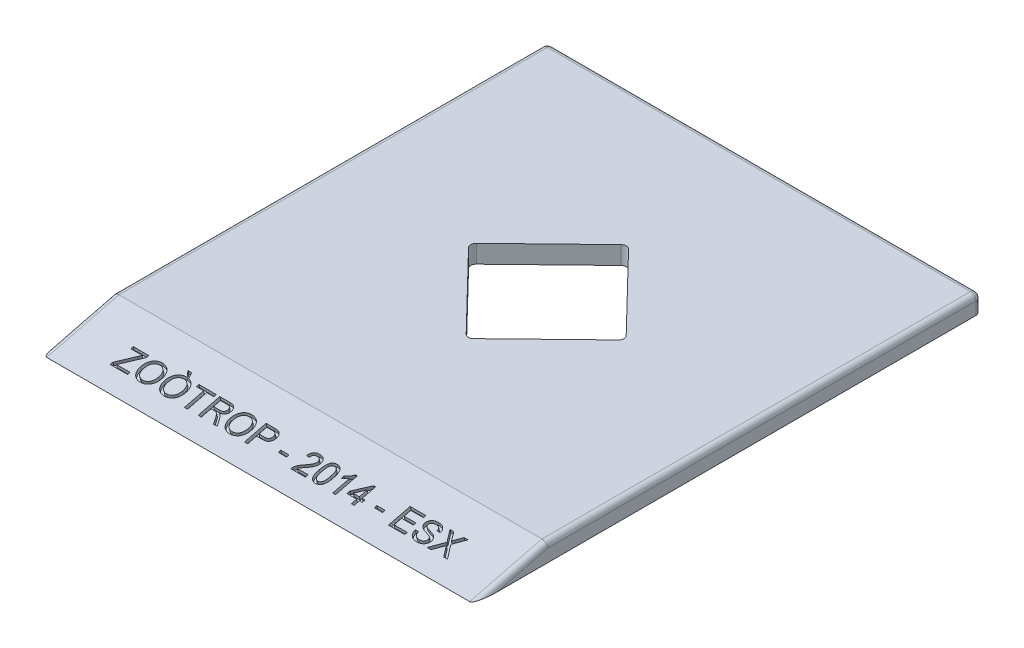
from build123d import *

# Parameters (mm, degrees)
SALIENTE_EXTRUIR1_DEPTH = 60
CROQUIS3_W              = 2.291730519
CROQUIS3_H              = 0.711226712
CORTAR_EXTRUIR1_DEPTH   = 1
CORTAR_EXTRUIR2_DEPTH   = 21
REDONDEO1_R             = 1.5
REDONDEO2_R             = 1.5


with BuildPart() as part:
    # Croquis2 → Saliente-Extruir1 (new, symmetric)
    with BuildSketch(Plane(origin=(0, 0, 0), x_dir=(0, 0, -1), z_dir=(1, 0, 0))):
        Polygon((60, 0), (-80, 0), (-60, 5), (60, 5), align=None)
    extrude(amount=SALIENTE_EXTRUIR1_DEPTH, both=True)

    # Croquis3 → Cortar-Extruir1 (cut)
    # profile 1 of 17: a face of its own
    with BuildSketch(Plane(origin=(0, 18.823529412, 4.705882353), x_dir=(1, 0, 0), z_dir=(0, 0.970142500145332, 0.24253562503633277))):
        with BuildLine():
            Line((-46.585349684, -71.764938026), (-46.585349684, -71.024076867))
            Line((-46.585349684, -71.024076867), (-43.550288469, -67.019722302))
            add(Edge.make_bspline(
                [(-43.550288469, -67.019722302), (-43.498711012, -66.952319346), (-43.399809549, -66.823071968), (-43.260120106, -66.636316957), (-43.13098584, -66.469147715), (-43.050921883, -66.362496205), (-43.013164129, -66.312199895)],
                knots=[0, 0, 0, 0, 1.146521337, 2.198492228, 3.150418105, 4, 4, 4, 4], degree=3))
            Line((-43.013164129, -66.312199895), (-46.190223733, -66.312199895))
            Line((-46.190223733, -66.312199895), (-46.190223733, -65.600973183))
            Line((-46.190223733, -65.600973183), (-41.922863457, -65.600973183))
            Line((-41.922863457, -65.600973183), (-41.922863457, -66.312199895))
            Line((-41.922863457, -66.312199895), (-45.215991309, -70.657350593))
            Line((-45.215991309, -70.657350593), (-45.516040078, -71.053711314))
            Line((-45.516040078, -71.053711314), (-41.764813076, -71.053711314))
            Line((-41.764813076, -71.053711314), (-41.764813076, -71.764938026))
            Line((-41.764813076, -71.764938026), (-46.585349684, -71.764938026))
        make_face()
    # profile 2 of 17: a face of its own
    with BuildSketch(Plane(origin=(0, 18.823529412, 4.705882353), x_dir=(1, 0, 0), z_dir=(0, 0.970142500145332, 0.24253562503633277))):
        with BuildLine():
            add(Edge.make_bspline(
                [(-41.132611553, -68.764450332), (-41.130469197, -68.64086815), (-41.126294923, -68.400074535), (-41.087292432, -68.049448004), (-41.023962397, -67.719554304), (-40.933426509, -67.410419134), (-40.818672011, -67.121558079), (-40.679165997, -66.852317055), (-40.510712219, -66.605743679), (-40.320148069, -66.379490731), (-40.107296667, -66.179466541), (-39.880670421, -66.001816403), (-39.637439481, -65.853635185), (-39.379851114, -65.731286351), (-39.106810939, -65.637350459), (-38.819085569, -65.571586787), (-38.516982724, -65.529162827), (-38.31048836, -65.524387869), (-38.204975206, -65.521947992)],
                knots=[0, 0, 0, 0, 1.203621547, 2.345195544, 3.432004029, 4.472479546, 5.478447225, 6.455936844, 7.420185704, 8.381829745, 9.332027588, 10.260832629, 11.182364398, 12.100723901, 13.034044877, 13.989196293, 14.972532542, 16, 16, 16, 16], degree=3))
            add(Edge.make_bspline(
                [(-38.204975206, -65.521947992), (-38.135382031, -65.52316322), (-37.997182573, -65.525576443), (-37.792867008, -65.543937845), (-37.593801634, -65.576709767), (-37.400182482, -65.620627817), (-37.211482518, -65.678246389), (-37.027589054, -65.74626336), (-36.850111872, -65.830545964), (-36.677870264, -65.924908726), (-36.512897415, -66.030457556), (-36.357856344, -66.147057134), (-36.213118424, -66.273825624), (-36.076739432, -66.408679295), (-35.953270144, -66.556169272), (-35.837609728, -66.711802758), (-35.733081755, -66.878339385), (-35.639315336, -67.054414669), (-35.55547863, -67.237309159), (-35.483823975, -67.427780878), (-35.42229543, -67.623544985), (-35.370790847, -67.825760193), (-35.333834919, -68.034357372), (-35.304406514, -68.248437697), (-35.288917532, -68.468700855), (-35.286149217, -68.617492543), (-35.284747471, -68.692833753)],
                knots=[0, 0, 0, 0, 1.034375294, 2.054082248, 3.045783978, 4.031219655, 5.002789406, 5.976610191, 6.94273282, 7.920236376, 8.894345378, 9.851183672, 10.800797181, 11.752517031, 12.698794154, 13.65688337, 14.632873302, 15.61821402, 16.620222298, 17.621258913, 18.640965868, 19.669244166, 20.720417492, 21.788124603, 22.880008887, 24, 24, 24, 24], degree=3))
            add(Edge.make_bspline(
                [(-35.284747471, -68.692833753), (-35.286031776, -68.769417341), (-35.288569141, -68.920721425), (-35.305737993, -69.144243849), (-35.335926802, -69.361349408), (-35.375967117, -69.572685472), (-35.429619918, -69.777812082), (-35.493378026, -69.977317349), (-35.57049706, -70.17001298), (-35.657594447, -70.356363411), (-35.756145103, -70.533805677), (-35.864853164, -70.701099019), (-35.983795642, -70.856678539), (-36.111165815, -71.0024528), (-36.249938114, -71.135815086), (-36.398403748, -71.258012433), (-36.555991866, -71.370197301), (-36.723231886, -71.469331371), (-36.897122457, -71.556225925), (-37.074222558, -71.63331705), (-37.254663744, -71.699063428), (-37.439062706, -71.752344333), (-37.626916424, -71.79260722), (-37.817696254, -71.822756495), (-38.012027599, -71.840116551), (-38.142792033, -71.842674406), (-38.208679512, -71.843963217)],
                knots=[0, 0, 0, 0, 1.141429366, 2.255090526, 3.338676798, 4.407031443, 5.458968682, 6.496860253, 7.526652771, 8.550250826, 9.560787671, 10.54935636, 11.521089193, 12.477323897, 13.431786008, 14.386110112, 15.340986122, 16.312041, 17.28047646, 18.236612773, 19.189437236, 20.140779471, 21.09494583, 22.051062463, 23.018000708, 24, 24, 24, 24], degree=3))
            add(Edge.make_bspline(
                [(-38.208679512, -71.843963217), (-38.279523186, -71.842915076), (-38.419846762, -71.840838971), (-38.627248787, -71.820115907), (-38.829490976, -71.788502151), (-39.025985374, -71.742861439), (-39.216463479, -71.683319905), (-39.401150672, -71.611252717), (-39.580696516, -71.527623029), (-39.752873144, -71.43003625), (-39.917094539, -71.321530242), (-40.071769005, -71.202644383), (-40.216811015, -71.074474312), (-40.349893237, -70.93490153), (-40.475325787, -70.788985606), (-40.588093306, -70.631302934), (-40.691878607, -70.465429592), (-40.783610512, -70.289766634), (-40.86647656, -70.109534096), (-40.936292996, -69.924674327), (-40.997648112, -69.737911668), (-41.046511251, -69.548094993), (-41.085449227, -69.355662166), (-41.111632194, -69.160933387), (-41.130541732, -68.963618642), (-41.131918141, -68.831173863), (-41.132611553, -68.764450332)],
                knots=[0, 0, 0, 0, 1.072727997, 2.12480551, 3.153819198, 4.171534612, 5.177148798, 6.173931848, 7.17235114, 8.174500385, 9.168706755, 10.151274001, 11.127173509, 12.097141049, 13.070188938, 14.039134204, 15.03036519, 16.031505612, 17.038625933, 18.033164522, 19.022845559, 20.014762458, 21.000193215, 21.994692725, 22.989758729, 24, 24, 24, 24], degree=3))
        make_face()
        with BuildLine():
            add(Edge.make_bspline(
                [(-40.26333446, -68.774328481), (-40.262002334, -68.863318802), (-40.259404783, -69.036843649), (-40.229687386, -69.289833648), (-40.184595984, -69.528542596), (-40.122442246, -69.753640606), (-40.038892401, -69.962901492), (-39.938997743, -70.158336047), (-39.819394796, -70.338645135), (-39.682722358, -70.50332436), (-39.532398344, -70.651259836), (-39.371761879, -70.780473605), (-39.200776853, -70.888680996), (-39.02133894, -70.978029297), (-38.83215932, -71.047773793), (-38.633804588, -71.096746621), (-38.426129006, -71.12737515), (-38.284519869, -71.130927121), (-38.212383818, -71.132736504)],
                knots=[0, 0, 0, 0, 1.215430442, 2.370003584, 3.475209778, 4.53279855, 5.55522989, 6.548792651, 7.526809858, 8.505409025, 9.467826767, 10.404123909, 11.316848639, 12.227335424, 13.138360512, 14.065900994, 15.014765094, 16, 16, 16, 16], degree=3))
            add(Edge.make_bspline(
                [(-38.212383818, -71.132736504), (-38.139025058, -71.130900359), (-37.995388812, -71.127305192), (-37.784582238, -71.097211341), (-37.584292394, -71.045977842), (-37.392534051, -70.977774448), (-37.212774013, -70.885575087), (-37.040808207, -70.77761014), (-36.881324442, -70.645680066), (-36.730407844, -70.497482951), (-36.595045822, -70.329029712), (-36.474940524, -70.144469887), (-36.377375434, -69.94103555), (-36.293141146, -69.723208081), (-36.231459946, -69.486870456), (-36.18587376, -69.234709361), (-36.158402559, -68.965913671), (-36.1555097, -68.781390418), (-36.154024564, -68.68665991)],
                knots=[0, 0, 0, 0, 0.976878588, 1.912725521, 2.8289017, 3.727303729, 4.617335839, 5.514666588, 6.426584173, 7.368641557, 8.327632997, 9.299405846, 10.294892156, 11.327373912, 12.405931897, 13.542618837, 14.738430195, 16, 16, 16, 16], degree=3))
            add(Edge.make_bspline(
                [(-36.154024564, -68.68665991), (-36.154549411, -68.625716468), (-36.155578969, -68.506167488), (-36.169213773, -68.329950923), (-36.186800922, -68.159215703), (-36.213577628, -67.994182136), (-36.250479327, -67.835533665), (-36.291360143, -67.682062495), (-36.342480174, -67.535091156), (-36.400482973, -67.394043283), (-36.465387123, -67.259642988), (-36.538590372, -67.133023321), (-36.619241948, -67.01467655), (-36.705165778, -66.902358939), (-36.801119837, -66.800417642), (-36.902483881, -66.70454661), (-37.01156039, -66.616726559), (-37.127260821, -66.536934549), (-37.247943813, -66.465109166), (-37.373360579, -66.403635957), (-37.501513051, -66.349639466), (-37.634546321, -66.308248889), (-37.770623456, -66.274866782), (-37.910294551, -66.249509962), (-38.054078028, -66.236379021), (-38.151034049, -66.234250481), (-38.200036132, -66.233174705)],
                knots=[0, 0, 0, 0, 1.220438779, 2.394059227, 3.538503547, 4.658058814, 5.74010225, 6.800155734, 7.837851593, 8.854470756, 9.853724944, 10.825214244, 11.781044712, 12.72106398, 13.654479919, 14.581868691, 15.514082315, 16.456304431, 17.39516604, 18.324312202, 19.252140633, 20.177768678, 21.111585046, 22.057694709, 23.018348693, 24, 24, 24, 24], degree=3))
            add(Edge.make_bspline(
                [(-38.200036132, -66.233174705), (-38.269293891, -66.234550137), (-38.405947168, -66.237264017), (-38.607117059, -66.267433008), (-38.801066646, -66.312509604), (-38.988096917, -66.375529086), (-39.166608232, -66.458976785), (-39.337525442, -66.561313968), (-39.502365689, -66.679754154), (-39.658529676, -66.817183112), (-39.804108669, -66.975055436), (-39.927181103, -67.16118207), (-40.030909913, -67.371119778), (-40.117521559, -67.604336418), (-40.183560388, -67.862638098), (-40.229201479, -68.144913225), (-40.258018333, -68.451459247), (-40.261517115, -68.663954016), (-40.26333446, -68.774328481)],
                knots=[0, 0, 0, 0, 0.895090134, 1.766112571, 2.624765742, 3.468151641, 4.313618154, 5.168136083, 6.041303099, 6.935189387, 7.854749729, 8.809996334, 9.809869957, 10.877771942, 12.021723904, 13.25217762, 14.572720513, 16, 16, 16, 16], degree=3))
        make_face(mode=Mode.SUBTRACT)
    # profile 3 of 17: a face of its own
    with BuildSketch(Plane(origin=(0, 18.823529412, 4.705882353), x_dir=(1, 0, 0), z_dir=(0, 0.970142500145332, 0.24253562503633277))):
        with BuildLine():
            add(Edge.make_bspline(
                [(-34.494495568, -68.764450332), (-34.492353211, -68.64086815), (-34.488178937, -68.400074535), (-34.449176446, -68.049448004), (-34.385846412, -67.719554304), (-34.295310524, -67.410419134), (-34.180556026, -67.121558079), (-34.041050012, -66.852317055), (-33.872596233, -66.605743679), (-33.682032083, -66.379490731), (-33.469180681, -66.179466541), (-33.242554435, -66.001816403), (-32.999323495, -65.853635185), (-32.741735129, -65.731286351), (-32.468694954, -65.637350459), (-32.180969583, -65.571586787), (-31.878866739, -65.529162827), (-31.672372374, -65.524387869), (-31.566859221, -65.521947992)],
                knots=[0, 0, 0, 0, 1.203621547, 2.345195544, 3.432004029, 4.472479546, 5.478447225, 6.455936844, 7.420185704, 8.381829745, 9.332027588, 10.260832629, 11.182364398, 12.100723901, 13.034044877, 13.989196293, 14.972532542, 16, 16, 16, 16], degree=3))
            add(Edge.make_bspline(
                [(-31.566859221, -65.521947992), (-31.497266046, -65.52316322), (-31.359066587, -65.525576443), (-31.154751022, -65.543937845), (-30.955685649, -65.576709767), (-30.762066496, -65.620627817), (-30.573366532, -65.678246389), (-30.389473068, -65.74626336), (-30.211995887, -65.830545964), (-30.039754279, -65.924908726), (-29.874781429, -66.030457556), (-29.719740358, -66.147057134), (-29.575002439, -66.273825624), (-29.438623447, -66.408679295), (-29.315154158, -66.556169272), (-29.199493742, -66.711802758), (-29.094965769, -66.878339385), (-29.001199351, -67.054414669), (-28.917362644, -67.237309159), (-28.845707989, -67.427780878), (-28.784179444, -67.623544985), (-28.732674861, -67.825760193), (-28.695718934, -68.034357372), (-28.666290529, -68.248437697), (-28.650801546, -68.468700855), (-28.648033231, -68.617492543), (-28.646631485, -68.692833753)],
                knots=[0, 0, 0, 0, 1.034375294, 2.054082248, 3.045783978, 4.031219655, 5.002789406, 5.976610191, 6.94273282, 7.920236376, 8.894345378, 9.851183672, 10.800797181, 11.752517031, 12.698794154, 13.65688337, 14.632873302, 15.61821402, 16.620222298, 17.621258913, 18.640965868, 19.669244166, 20.720417492, 21.788124603, 22.880008887, 24, 24, 24, 24], degree=3))
            add(Edge.make_bspline(
                [(-28.646631485, -68.692833753), (-28.64791579, -68.769417341), (-28.650453155, -68.920721425), (-28.667622007, -69.144243849), (-28.697810816, -69.361349408), (-28.737851132, -69.572685472), (-28.791503932, -69.777812082), (-28.85526204, -69.977317349), (-28.932381074, -70.17001298), (-29.019478461, -70.356363411), (-29.118029117, -70.533805677), (-29.226737178, -70.701099019), (-29.345679656, -70.856678539), (-29.473049829, -71.0024528), (-29.611822128, -71.135815086), (-29.760287762, -71.258012433), (-29.917875881, -71.370197301), (-30.0851159, -71.469331371), (-30.259006471, -71.556225925), (-30.436106572, -71.63331705), (-30.616547758, -71.699063428), (-30.800946721, -71.752344333), (-30.988800439, -71.79260722), (-31.179580269, -71.822756495), (-31.373911613, -71.840116551), (-31.504676047, -71.842674406), (-31.570563527, -71.843963217)],
                knots=[0, 0, 0, 0, 1.141429366, 2.255090526, 3.338676798, 4.407031443, 5.458968682, 6.496860253, 7.526652771, 8.550250826, 9.560787671, 10.54935636, 11.521089193, 12.477323897, 13.431786008, 14.386110112, 15.340986122, 16.312041, 17.28047646, 18.236612773, 19.189437236, 20.140779471, 21.09494583, 22.051062463, 23.018000708, 24, 24, 24, 24], degree=3))
            add(Edge.make_bspline(
                [(-31.570563527, -71.843963217), (-31.641407201, -71.842915076), (-31.781730777, -71.840838971), (-31.989132802, -71.820115907), (-32.19137499, -71.788502151), (-32.387869388, -71.742861439), (-32.578347494, -71.683319905), (-32.763034686, -71.611252717), (-32.94258053, -71.527623029), (-33.114757159, -71.43003625), (-33.278978553, -71.321530242), (-33.43365302, -71.202644383), (-33.578695029, -71.074474312), (-33.711777252, -70.93490153), (-33.837209801, -70.788985606), (-33.949977321, -70.631302934), (-34.053762622, -70.465429592), (-34.145494527, -70.289766634), (-34.228360575, -70.109534096), (-34.29817701, -69.924674327), (-34.359532126, -69.737911668), (-34.408395265, -69.548094993), (-34.447333241, -69.355662166), (-34.473516208, -69.160933387), (-34.492425746, -68.963618642), (-34.493802155, -68.831173863), (-34.494495568, -68.764450332)],
                knots=[0, 0, 0, 0, 1.072727997, 2.12480551, 3.153819198, 4.171534612, 5.177148798, 6.173931848, 7.17235114, 8.174500385, 9.168706755, 10.151274001, 11.127173509, 12.097141049, 13.070188938, 14.039134204, 15.03036519, 16.031505612, 17.038625933, 18.033164522, 19.022845559, 20.014762458, 21.000193215, 21.994692725, 22.989758729, 24, 24, 24, 24], degree=3))
        make_face()
        with BuildLine():
            add(Edge.make_bspline(
                [(-33.625218475, -68.774328481), (-33.623886349, -68.863318802), (-33.621288797, -69.036843649), (-33.591571401, -69.289833648), (-33.546479999, -69.528542596), (-33.48432626, -69.753640606), (-33.400776415, -69.962901492), (-33.300881757, -70.158336047), (-33.181278811, -70.338645135), (-33.044606372, -70.50332436), (-32.894282358, -70.651259836), (-32.733645893, -70.780473605), (-32.562660867, -70.888680996), (-32.383222954, -70.978029297), (-32.194043334, -71.047773793), (-31.995688603, -71.096746621), (-31.78801302, -71.12737515), (-31.646403883, -71.130927121), (-31.574267832, -71.132736504)],
                knots=[0, 0, 0, 0, 1.215430442, 2.370003584, 3.475209778, 4.53279855, 5.55522989, 6.548792651, 7.526809858, 8.505409025, 9.467826767, 10.404123909, 11.316848639, 12.227335424, 13.138360512, 14.065900994, 15.014765094, 16, 16, 16, 16], degree=3))
            add(Edge.make_bspline(
                [(-31.574267832, -71.132736504), (-31.500909072, -71.130900359), (-31.357272826, -71.127305192), (-31.146466252, -71.097211341), (-30.946176409, -71.045977842), (-30.754418065, -70.977774448), (-30.574658027, -70.885575087), (-30.402692221, -70.77761014), (-30.243208457, -70.645680066), (-30.092291859, -70.497482951), (-29.956929837, -70.329029712), (-29.836824538, -70.144469887), (-29.739259448, -69.94103555), (-29.655025161, -69.723208081), (-29.593343961, -69.486870456), (-29.547757774, -69.234709361), (-29.520286573, -68.965913671), (-29.517393714, -68.781390418), (-29.515908579, -68.68665991)],
                knots=[0, 0, 0, 0, 0.976878588, 1.912725521, 2.8289017, 3.727303729, 4.617335839, 5.514666588, 6.426584173, 7.368641557, 8.327632997, 9.299405846, 10.294892156, 11.327373912, 12.405931897, 13.542618837, 14.738430195, 16, 16, 16, 16], degree=3))
            add(Edge.make_bspline(
                [(-29.515908579, -68.68665991), (-29.516433425, -68.625716468), (-29.517462983, -68.506167488), (-29.531097788, -68.329950923), (-29.548684936, -68.159215703), (-29.575461643, -67.994182136), (-29.612363341, -67.835533665), (-29.653244157, -67.682062495), (-29.704364188, -67.535091156), (-29.762366987, -67.394043283), (-29.827271137, -67.259642988), (-29.900474386, -67.133023321), (-29.981125962, -67.01467655), (-30.067049792, -66.902358939), (-30.163003851, -66.800417642), (-30.264367895, -66.70454661), (-30.373444404, -66.616726559), (-30.489144835, -66.536934549), (-30.609827827, -66.465109166), (-30.735244593, -66.403635957), (-30.863397066, -66.349639466), (-30.996430336, -66.308248889), (-31.13250747, -66.274866782), (-31.272178565, -66.249509962), (-31.415962043, -66.236379021), (-31.512918064, -66.234250481), (-31.561920146, -66.233174705)],
                knots=[0, 0, 0, 0, 1.220438779, 2.394059227, 3.538503547, 4.658058814, 5.74010225, 6.800155734, 7.837851593, 8.854470756, 9.853724944, 10.825214244, 11.781044712, 12.72106398, 13.654479919, 14.581868691, 15.514082315, 16.456304431, 17.39516604, 18.324312202, 19.252140633, 20.177768678, 21.111585046, 22.057694709, 23.018348693, 24, 24, 24, 24], degree=3))
            add(Edge.make_bspline(
                [(-31.561920146, -66.233174705), (-31.631177906, -66.234550137), (-31.767831182, -66.237264017), (-31.969001074, -66.267433008), (-32.16295066, -66.312509604), (-32.349980932, -66.375529086), (-32.528492247, -66.458976785), (-32.699409457, -66.561313968), (-32.864249703, -66.679754154), (-33.02041369, -66.817183112), (-33.165992684, -66.975055436), (-33.289065118, -67.16118207), (-33.392793928, -67.371119778), (-33.479405573, -67.604336418), (-33.545444402, -67.862638098), (-33.591085494, -68.144913225), (-33.619902347, -68.451459247), (-33.62340113, -68.663954016), (-33.625218475, -68.774328481)],
                knots=[0, 0, 0, 0, 0.895090134, 1.766112571, 2.624765742, 3.468151641, 4.313618154, 5.168136083, 6.041303099, 6.935189387, 7.854749729, 8.809996334, 9.809869957, 10.877771942, 12.021723904, 13.25217762, 14.572720513, 16, 16, 16, 16], degree=3))
        make_face(mode=Mode.SUBTRACT)
    # profile 4 of 17: a face of its own
    with BuildSketch(Plane(origin=(0, 18.823529412, 4.705882353), x_dir=(1, 0, 0), z_dir=(0, 0.970142500145332, 0.24253562503633277))):
        Polygon((-31.017387195, -65.284872421), (-31.570563527, -65.284872421), (-32.51886581, -64.099494567), (-31.491538336, -64.099494567), align=None)
    # profile 5 of 17: a face of its own
    with BuildSketch(Plane(origin=(0, 18.823529412, 4.705882353), x_dir=(1, 0, 0), z_dir=(0, 0.970142500145332, 0.24253562503633277))):
        Polygon((-26.038800205, -71.764938026), (-26.038800205, -66.312199895), (-28.014429963, -66.312199895), (-28.014429963, -65.600973183), (-23.193893354, -65.600973183), (-23.193893354, -66.312199895), (-25.169523112, -66.312199895), (-25.169523112, -71.764938026), align=None)
    # profile 6 of 17: a face of its own
    with BuildSketch(Plane(origin=(0, 18.823529412, 4.705882353), x_dir=(1, 0, 0), z_dir=(0, 0.970142500145332, 0.24253562503633277))):
        with BuildLine():
            Line((-22.245591071, -71.764938026), (-22.245591071, -65.600973183))
            Line((-22.245591071, -65.600973183), (-19.571082286, -65.600973183))
            add(Edge.make_bspline(
                [(-19.571082286, -65.600973183), (-19.508105794, -65.601466629), (-19.386222164, -65.602421638), (-19.209465733, -65.609182015), (-19.044481326, -65.623755614), (-18.890965589, -65.63951493), (-18.748945799, -65.663703376), (-18.618568473, -65.691446977), (-18.499632316, -65.724462281), (-18.391605611, -65.7634559), (-18.291380384, -65.807571339), (-18.198479169, -65.862002668), (-18.109040182, -65.921647799), (-18.026382817, -65.991721926), (-17.948326977, -66.06844661), (-17.874945006, -66.152864375), (-17.807323266, -66.245707796), (-17.723919949, -66.378585986), (-17.634445194, -66.555551753), (-17.559898669, -66.78202959), (-17.511832403, -67.018933674), (-17.506689176, -67.180830172), (-17.504079652, -67.262971716)],
                knots=[0, 0, 0, 0, 1.242255013, 2.404239178, 3.487702428, 4.508875116, 5.447164253, 6.327763259, 7.137389581, 7.87956647, 8.591787438, 9.293660819, 10.000726923, 10.709654955, 11.427269343, 12.158170644, 12.913245971, 13.690346794, 15.251572448, 16.809945773, 18.381459854, 20, 20, 20, 20], degree=3))
            add(Edge.make_bspline(
                [(-17.504079652, -67.262971716), (-17.505285833, -67.315699262), (-17.507668123, -67.419839781), (-17.525916703, -67.572954219), (-17.558936035, -67.719248908), (-17.60127682, -67.86000507), (-17.659228438, -67.993228415), (-17.726362872, -68.12164007), (-17.80953289, -68.241712226), (-17.902650923, -68.356642211), (-18.009432336, -68.463968531), (-18.130816483, -68.559819117), (-18.26560011, -68.64603691), (-18.414417995, -68.72024313), (-18.575557093, -68.788071137), (-18.751039258, -68.842689517), (-18.940156259, -68.887289612), (-19.071260955, -68.9088867), (-19.138913277, -68.920031175)],
                knots=[0, 0, 0, 0, 0.982609109, 1.940720374, 2.867584677, 3.775009516, 4.675469332, 5.571146231, 6.471115823, 7.392408543, 8.32534739, 9.286126426, 10.269214477, 11.301811357, 12.381622301, 13.524260118, 14.722474812, 16, 16, 16, 16], degree=3))
            add(Edge.make_bspline(
                [(-19.138913277, -68.920031175), (-19.089287736, -68.945100904), (-18.995047047, -68.992709221), (-18.864569645, -69.067358649), (-18.753968468, -69.14363197), (-18.689891602, -69.198184891), (-18.659823061, -69.223784251)],
                knots=[0, 0, 0, 0, 1.172304973, 2.226249348, 3.167654437, 4, 4, 4, 4], degree=3))
            add(Edge.make_bspline(
                [(-18.659823061, -69.223784251), (-18.601593631, -69.280866108), (-18.481986246, -69.398116299), (-18.317162074, -69.597827721), (-18.157359378, -69.820137178), (-18.060267192, -69.980800977), (-18.010334778, -70.063426898)],
                knots=[0, 0, 0, 0, 0.918110279, 1.885863737, 2.912745394, 4, 4, 4, 4], degree=3))
            Line((-18.010334778, -70.063426898), (-16.999059296, -71.764938026))
            Line((-16.999059296, -71.764938026), (-17.995517555, -71.764938026))
            Line((-17.995517555, -71.764938026), (-18.763543623, -70.463491923))
            add(Edge.make_bspline(
                [(-18.763543623, -70.463491923), (-18.791157983, -70.417829123), (-18.844670077, -70.329342112), (-18.921966381, -70.200111094), (-18.997752866, -70.08113335), (-19.068043534, -69.969008433), (-19.135690898, -69.865771915), (-19.200041328, -69.771065173), (-19.25932387, -69.683645777), (-19.332752962, -69.58186685), (-19.41821223, -69.469247524), (-19.517937332, -69.353270884), (-19.612905197, -69.260804253), (-19.729859875, -69.170130886), (-19.874725937, -69.085321193), (-19.997864824, -69.046353469), (-20.057581114, -69.027456043)],
                knots=[0, 0, 0, 0, 1.130940588, 2.191577161, 3.191089816, 4.120344442, 4.99615009, 5.80661983, 6.546979556, 7.234477901, 8.466216387, 9.541989141, 10.473533583, 11.269175393, 12.675684693, 14, 14, 14, 14], degree=3))
            add(Edge.make_bspline(
                [(-20.057581114, -69.027456043), (-20.082635856, -69.022937822), (-20.139836583, -69.012622587), (-20.236963275, -69.00588569), (-20.354644177, -68.998735376), (-20.439929533, -68.998943712), (-20.486045818, -68.999056366)],
                knots=[0, 0, 0, 0, 0.709978628, 1.620902492, 2.713552433, 4, 4, 4, 4], degree=3))
            Line((-20.486045818, -68.999056366), (-21.376313977, -68.999056366))
            Line((-21.376313977, -68.999056366), (-21.376313977, -71.764938026))
            Line((-21.376313977, -71.764938026), (-22.245591071, -71.764938026))
        make_face()
        with BuildLine():
            Line((-21.376313977, -68.287829653), (-19.725428361, -68.287829653))
            add(Edge.make_bspline(
                [(-19.725428361, -68.287829653), (-19.642646703, -68.286534455), (-19.487894158, -68.284113205), (-19.271497204, -68.263438272), (-19.087078852, -68.230584926), (-18.930993413, -68.182664472), (-18.799857006, -68.116134969), (-18.685805182, -68.035056338), (-18.59102668, -67.933496912), (-18.512180757, -67.818908723), (-18.450892204, -67.69281014), (-18.406681565, -67.560362067), (-18.377744933, -67.422677643), (-18.37483243, -67.328971531), (-18.373356746, -67.281493245)],
                knots=[0, 0, 0, 0, 1.546323217, 2.890706218, 4.056530419, 5.041445823, 5.928701482, 6.793137403, 7.641659452, 8.509781392, 9.383301667, 10.251423607, 11.114044887, 12, 12, 12, 12], degree=3))
            add(Edge.make_bspline(
                [(-18.373356746, -67.281493245), (-18.374504029, -67.246894013), (-18.376751219, -67.179124281), (-18.388531732, -67.07965713), (-18.411435847, -66.985140346), (-18.441680675, -66.895074302), (-18.482093902, -66.810118667), (-18.530103167, -66.72961513), (-18.587393041, -66.654009873), (-18.653015296, -66.583072592), (-18.72836157, -66.518526598), (-18.814424728, -66.462837406), (-18.910525995, -66.415513606), (-19.016777074, -66.377954275), (-19.132843254, -66.347912924), (-19.259385274, -66.327927382), (-19.395824431, -66.31346591), (-19.490368854, -66.312629784), (-19.538978303, -66.312199895)],
                knots=[0, 0, 0, 0, 0.965208469, 1.890559848, 2.786986821, 3.67262109, 4.535197034, 5.405224191, 6.282113641, 7.175449223, 8.095446547, 9.040936516, 10.026471658, 11.075712529, 12.17809725, 13.364958037, 14.645208957, 16, 16, 16, 16], degree=3))
            Line((-19.538978303, -66.312199895), (-21.376313977, -66.312199895))
            Line((-21.376313977, -66.312199895), (-21.376313977, -68.287829653))
        make_face(mode=Mode.SUBTRACT)
    # profile 7 of 17: a face of its own
    with BuildSketch(Plane(origin=(0, 18.823529412, 4.705882353), x_dir=(1, 0, 0), z_dir=(0, 0.970142500145332, 0.24253562503633277))):
        with BuildLine():
            add(Edge.make_bspline(
                [(-16.397726988, -68.764450332), (-16.395584631, -68.64086815), (-16.391410357, -68.400074535), (-16.352407866, -68.049448004), (-16.289077832, -67.719554304), (-16.198541944, -67.410419134), (-16.083787446, -67.121558079), (-15.944281432, -66.852317055), (-15.775827654, -66.605743679), (-15.585263504, -66.379490731), (-15.372412101, -66.179466541), (-15.145785856, -66.001816403), (-14.902554916, -65.853635185), (-14.644966549, -65.731286351), (-14.371926374, -65.637350459), (-14.084201004, -65.571586787), (-13.782098159, -65.529162827), (-13.575603795, -65.524387869), (-13.470090641, -65.521947992)],
                knots=[0, 0, 0, 0, 1.203621547, 2.345195544, 3.432004029, 4.472479546, 5.478447225, 6.455936844, 7.420185704, 8.381829745, 9.332027588, 10.260832629, 11.182364398, 12.100723901, 13.034044877, 13.989196293, 14.972532542, 16, 16, 16, 16], degree=3))
            add(Edge.make_bspline(
                [(-13.470090641, -65.521947992), (-13.400497466, -65.52316322), (-13.262298008, -65.525576443), (-13.057982443, -65.543937845), (-12.858917069, -65.576709767), (-12.665297917, -65.620627817), (-12.476597952, -65.678246389), (-12.292704489, -65.74626336), (-12.115227307, -65.830545964), (-11.942985699, -65.924908726), (-11.77801285, -66.030457556), (-11.622971779, -66.147057134), (-11.478233859, -66.273825624), (-11.341854867, -66.408679295), (-11.218385578, -66.556169272), (-11.102725163, -66.711802758), (-10.99819719, -66.878339385), (-10.904430771, -67.054414669), (-10.820594065, -67.237309159), (-10.74893941, -67.427780878), (-10.687410865, -67.623544985), (-10.635906282, -67.825760193), (-10.598950354, -68.034357372), (-10.569521949, -68.248437697), (-10.554032966, -68.468700855), (-10.551264652, -68.617492543), (-10.549862906, -68.692833753)],
                knots=[0, 0, 0, 0, 1.034375294, 2.054082248, 3.045783978, 4.031219655, 5.002789406, 5.976610191, 6.94273282, 7.920236376, 8.894345378, 9.851183672, 10.800797181, 11.752517031, 12.698794154, 13.65688337, 14.632873302, 15.61821402, 16.620222298, 17.621258913, 18.640965868, 19.669244166, 20.720417492, 21.788124603, 22.880008887, 24, 24, 24, 24], degree=3))
            add(Edge.make_bspline(
                [(-10.549862906, -68.692833753), (-10.55114721, -68.769417341), (-10.553684576, -68.920721425), (-10.570853427, -69.144243849), (-10.601042237, -69.361349408), (-10.641082552, -69.572685472), (-10.694735352, -69.777812082), (-10.758493461, -69.977317349), (-10.835612494, -70.17001298), (-10.922709881, -70.356363411), (-11.021260537, -70.533805677), (-11.129968598, -70.701099019), (-11.248911077, -70.856678539), (-11.37628125, -71.0024528), (-11.515053549, -71.135815086), (-11.663519182, -71.258012433), (-11.821107301, -71.370197301), (-11.988347321, -71.469331371), (-12.162237891, -71.556225925), (-12.339337993, -71.63331705), (-12.519779178, -71.699063428), (-12.704178141, -71.752344333), (-12.892031859, -71.79260722), (-13.082811689, -71.822756495), (-13.277143034, -71.840116551), (-13.407907468, -71.842674406), (-13.473794947, -71.843963217)],
                knots=[0, 0, 0, 0, 1.141429366, 2.255090526, 3.338676798, 4.407031443, 5.458968682, 6.496860253, 7.526652771, 8.550250826, 9.560787671, 10.54935636, 11.521089193, 12.477323897, 13.431786008, 14.386110112, 15.340986122, 16.312041, 17.28047646, 18.236612773, 19.189437236, 20.140779471, 21.09494583, 22.051062463, 23.018000708, 24, 24, 24, 24], degree=3))
            add(Edge.make_bspline(
                [(-13.473794947, -71.843963217), (-13.544638621, -71.842915076), (-13.684962197, -71.840838971), (-13.892364222, -71.820115907), (-14.09460641, -71.788502151), (-14.291100808, -71.742861439), (-14.481578914, -71.683319905), (-14.666266107, -71.611252717), (-14.845811951, -71.527623029), (-15.017988579, -71.43003625), (-15.182209973, -71.321530242), (-15.33688444, -71.202644383), (-15.48192645, -71.074474312), (-15.615008672, -70.93490153), (-15.740441222, -70.788985606), (-15.853208741, -70.631302934), (-15.956994042, -70.465429592), (-16.048725947, -70.289766634), (-16.131591995, -70.109534096), (-16.201408431, -69.924674327), (-16.262763547, -69.737911668), (-16.311626686, -69.548094993), (-16.350564661, -69.355662166), (-16.376747629, -69.160933387), (-16.395657166, -68.963618642), (-16.397033576, -68.831173863), (-16.397726988, -68.764450332)],
                knots=[0, 0, 0, 0, 1.072727997, 2.12480551, 3.153819198, 4.171534612, 5.177148798, 6.173931848, 7.17235114, 8.174500385, 9.168706755, 10.151274001, 11.127173509, 12.097141049, 13.070188938, 14.039134204, 15.03036519, 16.031505612, 17.038625933, 18.033164522, 19.022845559, 20.014762458, 21.000193215, 21.994692725, 22.989758729, 24, 24, 24, 24], degree=3))
        make_face()
        with BuildLine():
            add(Edge.make_bspline(
                [(-15.528449895, -68.774328481), (-15.527117769, -68.863318802), (-15.524520217, -69.036843649), (-15.494802821, -69.289833648), (-15.449711419, -69.528542596), (-15.38755768, -69.753640606), (-15.304007835, -69.962901492), (-15.204113178, -70.158336047), (-15.084510231, -70.338645135), (-14.947837792, -70.50332436), (-14.797513778, -70.651259836), (-14.636877313, -70.780473605), (-14.465892288, -70.888680996), (-14.286454374, -70.978029297), (-14.097274754, -71.047773793), (-13.898920023, -71.096746621), (-13.69124444, -71.12737515), (-13.549635304, -71.130927121), (-13.477499253, -71.132736504)],
                knots=[0, 0, 0, 0, 1.215430442, 2.370003584, 3.475209778, 4.53279855, 5.55522989, 6.548792651, 7.526809858, 8.505409025, 9.467826767, 10.404123909, 11.316848639, 12.227335424, 13.138360512, 14.065900994, 15.014765094, 16, 16, 16, 16], degree=3))
            add(Edge.make_bspline(
                [(-13.477499253, -71.132736504), (-13.404140492, -71.130900359), (-13.260504246, -71.127305192), (-13.049697672, -71.097211341), (-12.849407829, -71.045977842), (-12.657649485, -70.977774448), (-12.477889448, -70.885575087), (-12.305923641, -70.77761014), (-12.146439877, -70.645680066), (-11.995523279, -70.497482951), (-11.860161257, -70.329029712), (-11.740055959, -70.144469887), (-11.642490868, -69.94103555), (-11.558256581, -69.723208081), (-11.496575381, -69.486870456), (-11.450989195, -69.234709361), (-11.423517993, -68.965913671), (-11.420625134, -68.781390418), (-11.419139999, -68.68665991)],
                knots=[0, 0, 0, 0, 0.976878588, 1.912725521, 2.8289017, 3.727303729, 4.617335839, 5.514666588, 6.426584173, 7.368641557, 8.327632997, 9.299405846, 10.294892156, 11.327373912, 12.405931897, 13.542618837, 14.738430195, 16, 16, 16, 16], degree=3))
            add(Edge.make_bspline(
                [(-11.419139999, -68.68665991), (-11.419664845, -68.625716468), (-11.420694404, -68.506167488), (-11.434329208, -68.329950923), (-11.451916356, -68.159215703), (-11.478693063, -67.994182136), (-11.515594762, -67.835533665), (-11.556475578, -67.682062495), (-11.607595608, -67.535091156), (-11.665598407, -67.394043283), (-11.730502557, -67.259642988), (-11.803705806, -67.133023321), (-11.884357383, -67.01467655), (-11.970281212, -66.902358939), (-12.066235272, -66.800417642), (-12.167599316, -66.70454661), (-12.276675825, -66.616726559), (-12.392376256, -66.536934549), (-12.513059248, -66.465109166), (-12.638476014, -66.403635957), (-12.766628486, -66.349639466), (-12.899661756, -66.308248889), (-13.03573889, -66.274866782), (-13.175409985, -66.249509962), (-13.319193463, -66.236379021), (-13.416149484, -66.234250481), (-13.465151567, -66.233174705)],
                knots=[0, 0, 0, 0, 1.220438779, 2.394059227, 3.538503547, 4.658058814, 5.74010225, 6.800155734, 7.837851593, 8.854470756, 9.853724944, 10.825214244, 11.781044712, 12.72106398, 13.654479919, 14.581868691, 15.514082315, 16.456304431, 17.39516604, 18.324312202, 19.252140633, 20.177768678, 21.111585046, 22.057694709, 23.018348693, 24, 24, 24, 24], degree=3))
            add(Edge.make_bspline(
                [(-13.465151567, -66.233174705), (-13.534409326, -66.234550137), (-13.671062603, -66.237264017), (-13.872232494, -66.267433008), (-14.066182081, -66.312509604), (-14.253212352, -66.375529086), (-14.431723667, -66.458976785), (-14.602640877, -66.561313968), (-14.767481124, -66.679754154), (-14.92364511, -66.817183112), (-15.069224104, -66.975055436), (-15.192296538, -67.16118207), (-15.296025348, -67.371119778), (-15.382636994, -67.604336418), (-15.448675823, -67.862638098), (-15.494316914, -68.144913225), (-15.523133768, -68.451459247), (-15.52663255, -68.663954016), (-15.528449895, -68.774328481)],
                knots=[0, 0, 0, 0, 0.895090134, 1.766112571, 2.624765742, 3.468151641, 4.313618154, 5.168136083, 6.041303099, 6.935189387, 7.854749729, 8.809996334, 9.809869957, 10.877771942, 12.021723904, 13.25217762, 14.572720513, 16, 16, 16, 16], degree=3))
        make_face(mode=Mode.SUBTRACT)
    # profile 8 of 17: a face of its own
    with BuildSketch(Plane(origin=(0, 18.823529412, 4.705882353), x_dir=(1, 0, 0), z_dir=(0, 0.970142500145332, 0.24253562503633277))):
        with BuildLine():
            Line((-9.443510241, -71.764938026), (-9.443510241, -65.600973183))
            Line((-9.443510241, -65.600973183), (-7.178944632, -65.600973183))
            add(Edge.make_bspline(
                [(-7.178944632, -65.600973183), (-7.085080212, -65.601507936), (-6.908802393, -65.602512205), (-6.662632683, -65.614273488), (-6.451242754, -65.628824142), (-6.323562389, -65.649540489), (-6.265215869, -65.659007307)],
                knots=[0, 0, 0, 0, 1.22865052, 2.30741144, 3.226532197, 4, 4, 4, 4], degree=3))
            add(Edge.make_bspline(
                [(-6.265215869, -65.659007307), (-6.1940472, -65.672703876), (-6.056102481, -65.699251646), (-5.86079414, -65.763252559), (-5.682856927, -65.84289681), (-5.522568925, -65.942125329), (-5.377267254, -66.058694567), (-5.249022628, -66.198371879), (-5.135343446, -66.358038515), (-5.038681417, -66.537569546), (-4.958225088, -66.730744859), (-4.901873162, -66.936543409), (-4.865779651, -67.151389726), (-4.861980569, -67.298220656), (-4.860049204, -67.372866121)],
                knots=[0, 0, 0, 0, 1.070909925, 2.075721949, 3.031861647, 3.947440733, 4.85625699, 5.777986723, 6.742441087, 7.747548058, 8.78749499, 9.830146138, 10.896896232, 12, 12, 12, 12], degree=3))
            add(Edge.make_bspline(
                [(-4.860049204, -67.372866121), (-4.861410317, -67.436732754), (-4.864088382, -67.562393852), (-4.887084501, -67.74700814), (-4.923354353, -67.924614592), (-4.977455755, -68.093997819), (-5.043596173, -68.257138076), (-5.126948383, -68.411283965), (-5.224280247, -68.558528657), (-5.3359501, -68.698471487), (-5.467416531, -68.828272694), (-5.62558681, -68.9383835), (-5.807411398, -69.030845624), (-6.012932702, -69.10555402), (-6.241651814, -69.16433749), (-6.494318141, -69.207407302), (-6.771423884, -69.231185422), (-6.964050343, -69.234440875), (-7.064111152, -69.236131937)],
                knots=[0, 0, 0, 0, 0.928769099, 1.82740408, 2.702266355, 3.562020322, 4.410419678, 5.259600434, 6.10654066, 6.975254961, 7.860221694, 8.783881459, 9.766664779, 10.81996744, 11.958551584, 13.197863772, 14.544415867, 16, 16, 16, 16], degree=3))
            Line((-7.064111152, -69.236131937), (-8.574233148, -69.236131937))
            Line((-8.574233148, -69.236131937), (-8.574233148, -71.764938026))
            Line((-8.574233148, -71.764938026), (-9.443510241, -71.764938026))
        make_face()
        with BuildLine():
            Line((-8.574233148, -68.524905224), (-7.087571755, -68.524905224))
            add(Edge.make_bspline(
                [(-7.087571755, -68.524905224), (-7.028277857, -68.523913807), (-6.914053657, -68.522003935), (-6.749004898, -68.508675811), (-6.597530863, -68.485605442), (-6.459211378, -68.453429031), (-6.333870317, -68.413434677), (-6.221731941, -68.362852827), (-6.123374512, -68.302177023), (-6.03814629, -68.232025558), (-5.964987479, -68.153438802), (-5.901597109, -68.067704989), (-5.847737224, -67.974211453), (-5.805517438, -67.872567027), (-5.769751459, -67.764748891), (-5.747427032, -67.648523047), (-5.731904927, -67.52557494), (-5.730197892, -67.440830939), (-5.729326297, -67.397561493)],
                knots=[0, 0, 0, 0, 1.403696362, 2.704090955, 3.91683431, 5.027708188, 6.063065288, 7.026749679, 7.932587242, 8.790956304, 9.632005367, 10.468072405, 11.310475089, 12.179234342, 13.069796908, 13.994719932, 14.976123913, 16, 16, 16, 16], degree=3))
            add(Edge.make_bspline(
                [(-5.729326297, -67.397561493), (-5.731167661, -67.334813896), (-5.734735581, -67.213230961), (-5.770683261, -67.038276861), (-5.82704163, -66.87661617), (-5.907730228, -66.731309636), (-6.005386902, -66.603837103), (-6.120180253, -66.499543589), (-6.248429975, -66.416164768), (-6.344187316, -66.383150821), (-6.392397034, -66.366529714)],
                knots=[0, 0, 0, 0, 1.143156811, 2.215038775, 3.243253804, 4.254666983, 5.233799895, 6.158487526, 7.072877374, 8, 8, 8, 8], degree=3))
            add(Edge.make_bspline(
                [(-6.392397034, -66.366529714), (-6.410052978, -66.362212445), (-6.448420558, -66.352830724), (-6.511976154, -66.342182329), (-6.585633741, -66.332099245), (-6.669752363, -66.325409588), (-6.763564879, -66.318765908), (-6.867358086, -66.315703337), (-6.981368422, -66.313058148), (-7.060816325, -66.31249472), (-7.102388979, -66.312199895)],
                knots=[0, 0, 0, 0, 0.611063981, 1.327884044, 2.165719042, 3.110592661, 4.16481496, 5.328235826, 6.601947678, 8, 8, 8, 8], degree=3))
            Line((-7.102388979, -66.312199895), (-8.574233148, -66.312199895))
            Line((-8.574233148, -66.312199895), (-8.574233148, -68.524905224))
        make_face(mode=Mode.SUBTRACT)
    # profile 9 of 17: a face of its own
    with BuildSketch(Plane(origin=(0, 18.823529412, 4.705882353), x_dir=(1, 0, 0), z_dir=(0, 0.970142500145332, 0.24253562503633277))):
        with Locations((-0.711226713, -69.591745293)):
            Rectangle(CROQUIS3_W, CROQUIS3_H)
    # profile 10 of 17: a face of its own
    with BuildSketch(Plane(origin=(0, 18.823529412, 4.705882353), x_dir=(1, 0, 0), z_dir=(0, 0.970142500145332, 0.24253562503633277))):
        with BuildLine():
            Line((7.388855293, -70.974686123), (7.388855293, -71.764938026))
            Line((7.388855293, -71.764938026), (3.358570588, -71.764938026))
            add(Edge.make_bspline(
                [(3.358570588, -71.764938026), (3.358488077, -71.717971134), (3.358323333, -71.624194772), (3.374191804, -71.485505481), (3.399045007, -71.34865602), (3.427146514, -71.260899903), (3.441300084, -71.216700769)],
                knots=[0, 0, 0, 0, 1.01057331, 2.01775941, 3.001627217, 4, 4, 4, 4], degree=3))
            add(Edge.make_bspline(
                [(3.441300084, -71.216700769), (3.467451172, -71.144484656), (3.520699094, -70.997440757), (3.628579942, -70.785276945), (3.755473313, -70.574396257), (3.879021871, -70.402709605), (3.992165672, -70.265543972), (4.087051496, -70.158227739), (4.192202384, -70.048376928), (4.307534126, -69.936011605), (4.431936722, -69.820404025), (4.565579921, -69.701168642), (4.710041837, -69.580527537), (4.810891374, -69.500561593), (4.862518741, -69.459625053)],
                knots=[0, 0, 0, 0, 1.204657718, 2.452881516, 3.728232997, 5.065887527, 5.768225529, 6.518857853, 7.313994055, 8.154655305, 9.046094665, 9.979688118, 10.965752482, 12, 12, 12, 12], degree=3))
            add(Edge.make_bspline(
                [(4.862518741, -69.459625053), (4.941831129, -69.392869103), (5.094552164, -69.264326288), (5.310218196, -69.073580663), (5.507194012, -68.896462546), (5.682342995, -68.729867581), (5.83709768, -68.575411629), (5.971821434, -68.433444632), (6.087673461, -68.304409639), (6.183239436, -68.183636131), (6.26387138, -68.069592347), (6.332199832, -67.958349677), (6.389142531, -67.847964957), (6.43656818, -67.738787475), (6.474077838, -67.630350337), (6.499646006, -67.522337618), (6.516985454, -67.415821067), (6.518720279, -67.344943772), (6.5195782, -67.309892923)],
                knots=[0, 0, 0, 0, 1.782554561, 3.432421876, 4.950675607, 6.337395053, 7.588547463, 8.709982106, 9.702713005, 10.569305638, 11.356701089, 12.103210377, 12.812277205, 13.490692607, 14.148717897, 14.782152033, 15.397739362, 16, 16, 16, 16], degree=3))
            add(Edge.make_bspline(
                [(6.5195782, -67.309892923), (6.518720176, -67.275251039), (6.517036779, -67.207285547), (6.501064795, -67.107818474), (6.478830512, -67.012029306), (6.442884444, -66.921642458), (6.400097802, -66.833981224), (6.345213606, -66.751815587), (6.281723874, -66.673097771), (6.209033504, -66.599903192), (6.129638598, -66.531234992), (6.040926104, -66.474155036), (5.948722635, -66.422766068), (5.849847249, -66.38144639), (5.744460613, -66.351104613), (5.633329893, -66.329084298), (5.516472723, -66.315122237), (5.436725918, -66.313188778), (5.395938775, -66.312199895)],
                knots=[0, 0, 0, 0, 0.988194508, 1.938783882, 2.870742509, 3.789494954, 4.709148727, 5.651055405, 6.603531303, 7.592354411, 8.592907906, 9.593461401, 10.59787167, 11.603930315, 12.645063138, 13.723588815, 14.835711238, 16, 16, 16, 16], degree=3))
            add(Edge.make_bspline(
                [(5.395938775, -66.312199895), (5.353093016, -66.313183881), (5.269240716, -66.315109613), (5.146671109, -66.329127357), (5.030312513, -66.350544574), (4.920442658, -66.383289666), (4.81719527, -66.424540441), (4.720990852, -66.476464181), (4.630288771, -66.535076691), (4.547945586, -66.604469482), (4.473483723, -66.681411933), (4.407378923, -66.765178987), (4.353215972, -66.857387174), (4.308485975, -66.956009043), (4.272519312, -67.061354625), (4.246408738, -67.174229264), (4.232173079, -67.294307052), (4.229310407, -67.376536287), (4.227847681, -67.41855256)],
                knots=[0, 0, 0, 0, 1.131143733, 2.213731411, 3.253917892, 4.251203413, 5.236093891, 6.184197493, 7.13373276, 8.082770301, 9.020476205, 9.957489029, 10.893177274, 11.836722509, 12.812818608, 13.827831385, 14.890097571, 16, 16, 16, 16], degree=3))
            Line((4.227847681, -67.41855256), (3.437595778, -67.339527369))
            add(Edge.make_bspline(
                [(3.437595778, -67.339527369), (3.445681178, -67.270654985), (3.461410627, -67.136669689), (3.500590538, -66.942614557), (3.555595589, -66.762087658), (3.621413773, -66.59257207), (3.70392307, -66.436953456), (3.797192727, -66.292013022), (3.907199984, -66.16234767), (4.028728818, -66.043870161), (4.163110708, -65.939460302), (4.309083346, -65.848243794), (4.466579959, -65.771946817), (4.634723345, -65.708776101), (4.813899522, -65.660846889), (5.003855013, -65.626477121), (5.204895301, -65.605291204), (5.342791283, -65.60243306), (5.413225536, -65.600973183)],
                knots=[0, 0, 0, 0, 1.130804643, 2.199883102, 3.223565206, 4.205909148, 5.160801384, 6.091796021, 7.01151579, 7.927798993, 8.855738875, 9.7815393, 10.730299821, 11.705391175, 12.706931101, 13.751121791, 14.851322166, 16, 16, 16, 16], degree=3))
            add(Edge.make_bspline(
                [(5.413225536, -65.600973183), (5.484502848, -65.602193726), (5.623351472, -65.604571351), (5.825676234, -65.628899231), (6.016575239, -65.666789682), (6.196748318, -65.71959737), (6.365130982, -65.788843996), (6.521852757, -65.873447738), (6.667636254, -65.972583309), (6.800045729, -66.087440768), (6.919442815, -66.212826924), (7.024076755, -66.346640983), (7.111555766, -66.488311288), (7.186038713, -66.635906775), (7.241285463, -66.79254604), (7.280135996, -66.956099542), (7.30653606, -67.126707044), (7.308717491, -67.243112932), (7.309830103, -67.302484311)],
                knots=[0, 0, 0, 0, 1.195390245, 2.328627238, 3.413424916, 4.457841177, 5.473507151, 6.462241215, 7.441013641, 8.425227782, 9.397253344, 10.342087291, 11.269524934, 12.186751184, 13.110685745, 14.048630397, 15.004728144, 16, 16, 16, 16], degree=3))
            add(Edge.make_bspline(
                [(7.309830103, -67.302484311), (7.308131163, -67.363481676), (7.304729532, -67.485611017), (7.278179355, -67.668158363), (7.232751705, -67.848724664), (7.172526766, -68.029507521), (7.090246965, -68.211224452), (6.986300407, -68.396382248), (6.857343344, -68.585664865), (6.733322806, -68.746576119), (6.617879813, -68.881460328), (6.515550511, -68.992477912), (6.397161429, -69.110426671), (6.267153788, -69.239391444), (6.120225248, -69.374795001), (5.960597411, -69.520692079), (5.784775945, -69.673243223), (5.662721582, -69.777458842), (5.599675594, -69.831290401)],
                knots=[0, 0, 0, 0, 0.927118007, 1.856282007, 2.79721255, 3.754929441, 4.749232485, 5.824981375, 6.979078785, 8.228161913, 8.911614355, 9.677694854, 10.522803217, 11.452009355, 12.461436787, 13.560019032, 14.739651695, 16, 16, 16, 16], degree=3))
            add(Edge.make_bspline(
                [(5.599675594, -69.831290401), (5.545686229, -69.8752435), (5.442736819, -69.959055294), (5.29627134, -70.080559497), (5.165082819, -70.191975559), (5.046103433, -70.2896693), (4.943666334, -70.378366042), (4.85416332, -70.454181257), (4.780846083, -70.520926905), (4.669196911, -70.622314891), (4.527783709, -70.766833218), (4.423584413, -70.907257638), (4.373550376, -70.974686123)],
                knots=[0, 0, 0, 0, 1.241996727, 2.368296581, 3.394949853, 4.3125351, 5.114548721, 5.812230366, 6.404953749, 6.883082049, 8.503329734, 10, 10, 10, 10], degree=3))
            Line((4.373550376, -70.974686123), (7.388855293, -70.974686123))
        make_face()
    # profile 11 of 17: a face of its own
    with BuildSketch(Plane(origin=(0, 18.823529412, 4.705882353), x_dir=(1, 0, 0), z_dir=(0, 0.970142500145332, 0.24253562503633277))):
        with BuildLine():
            add(Edge.make_bspline(
                [(8.258132387, -68.724937737), (8.258928566, -68.636849021), (8.260487945, -68.464320322), (8.270160268, -68.211879843), (8.287047361, -67.972147571), (8.312255142, -67.745331705), (8.342105876, -67.530920276), (8.38091202, -67.329219272), (8.424574573, -67.139776143), (8.476961801, -66.962788353), (8.534518215, -66.796734131), (8.599817803, -66.641879863), (8.673288698, -66.498389732), (8.751320261, -66.364775665), (8.838020235, -66.243115911), (8.928155582, -66.129996198), (9.028276802, -66.029565068), (9.13422064, -65.93923842), (9.247547146, -65.859530416), (9.367656709, -65.790752024), (9.494087182, -65.730025662), (9.62924819, -65.684310873), (9.770333815, -65.647043628), (9.918430062, -65.619629392), (10.07370013, -65.603467774), (10.179805396, -65.601814107), (10.233762144, -65.600973183)],
                knots=[0, 0, 0, 0, 1.514747001, 2.966751498, 4.343369068, 5.64627492, 6.890416844, 8.064737671, 9.177176366, 10.232018008, 11.237056675, 12.19799043, 13.119080079, 14.007588942, 14.855863561, 15.685992447, 16.491747269, 17.290132607, 18.077525251, 18.870243746, 19.668095604, 20.485086593, 21.319398728, 22.175900658, 23.072407314, 24, 24, 24, 24], degree=3))
            add(Edge.make_bspline(
                [(10.233762144, -65.600973183), (10.312923712, -65.603300477), (10.468439786, -65.607872539), (10.695494058, -65.645161451), (10.909478074, -65.708949883), (11.110252813, -65.795003229), (11.29438606, -65.904307541), (11.45882481, -66.037183585), (11.601795327, -66.192236188), (11.721737307, -66.371302675), (11.826578571, -66.569443194), (11.919717247, -66.787547075), (12.003911906, -67.025369905), (12.063658268, -67.238254539), (12.1062753, -67.422024109), (12.134484388, -67.573592052), (12.157903587, -67.737134716), (12.175845859, -67.912256446), (12.190567069, -68.098760829), (12.201935585, -68.296763986), (12.207706271, -68.506760791), (12.208819492, -68.650848715), (12.209391902, -68.724937737)],
                knots=[0, 0, 0, 0, 1.134486744, 2.228744715, 3.287356444, 4.328707449, 5.352829806, 6.347195599, 7.349461267, 8.364207941, 9.428085653, 10.559314403, 11.761222316, 13.04268526, 13.726896727, 14.465273606, 15.252205015, 16.094778733, 16.988606776, 17.934225168, 18.937792761, 20, 20, 20, 20], degree=3))
            add(Edge.make_bspline(
                [(12.209391902, -68.724937737), (12.208580809, -68.812612687), (12.20699618, -68.98390296), (12.197583031, -69.234319292), (12.179678373, -69.4722429), (12.157646363, -69.698218797), (12.124316548, -69.911643733), (12.088401866, -70.113424496), (12.043984277, -70.302644821), (11.992159377, -70.479387641), (11.933792772, -70.644587506), (11.869784758, -70.799492907), (11.798889737, -70.943997994), (11.718997605, -71.076693337), (11.633763788, -71.199340244), (11.54256404, -71.312398792), (11.44346482, -71.414241741), (11.336566263, -71.504297458), (11.224035452, -71.585418969), (11.10363388, -71.654876412), (10.975888526, -71.712420697), (10.841652905, -71.761618202), (10.699565004, -71.797667248), (10.550745315, -71.82526223), (10.394645507, -71.841512153), (10.288129835, -71.843134923), (10.233762144, -71.843963217)],
                knots=[0, 0, 0, 0, 1.508974709, 2.94807912, 4.311757619, 5.615040294, 6.854280449, 8.028314546, 9.141715822, 10.197470207, 11.196696834, 12.155719058, 13.080757287, 13.963948316, 14.818758719, 15.649605906, 16.461113142, 17.260189315, 18.052359509, 18.845763934, 19.647754795, 20.461145776, 21.303032214, 22.167241874, 23.064524267, 24, 24, 24, 24], degree=3))
            add(Edge.make_bspline(
                [(10.233762144, -71.843963217), (10.162479799, -71.841929884), (10.023498844, -71.837965445), (9.820527407, -71.811029523), (9.630027887, -71.763621036), (9.45039353, -71.70003957), (9.283643475, -71.614995699), (9.128981556, -71.511523222), (8.983299955, -71.392029537), (8.899436768, -71.297751763), (8.856995157, -71.250039521)],
                knots=[0, 0, 0, 0, 1.10322584, 2.150986741, 3.161425019, 4.136713905, 5.093944212, 6.049774532, 7.013026876, 8, 8, 8, 8], degree=3))
            add(Edge.make_bspline(
                [(8.856995157, -71.250039521), (8.808143886, -71.179570846), (8.707410475, -71.034261422), (8.589510751, -70.786495375), (8.48434211, -70.513739745), (8.401804008, -70.210643097), (8.3371561, -69.87961774), (8.29046417, -69.52001413), (8.264041134, -69.131987629), (8.260146431, -68.863684005), (8.258132387, -68.724937737)],
                knots=[0, 0, 0, 0, 0.779365345, 1.607084704, 2.489375761, 3.438383567, 4.461919411, 5.557722155, 6.737039282, 8, 8, 8, 8], degree=3))
        make_face()
        with BuildLine():
            add(Edge.make_bspline(
                [(9.04838429, -68.7224682), (9.049168947, -68.841023663), (9.050670955, -69.067965044), (9.066363289, -69.392189961), (9.093376995, -69.684685092), (9.12909088, -69.945045461), (9.176247668, -70.173623254), (9.235458592, -70.369835986), (9.302203387, -70.536038655), (9.384798806, -70.670171306), (9.475231668, -70.779508984), (9.568597416, -70.873542922), (9.667092626, -70.953469617), (9.770074628, -71.020112181), (9.879141261, -71.070569551), (9.993099899, -71.107141166), (10.111975341, -71.128187568), (10.192934918, -71.13121154), (10.233762144, -71.132736504)],
                knots=[0, 0, 0, 0, 1.89448813, 3.626469325, 5.185477471, 6.587276848, 7.82441448, 8.910550357, 9.859733512, 10.6775885, 11.416198291, 12.123144072, 12.791880183, 13.439617036, 14.078171869, 14.70637855, 15.347637704, 16, 16, 16, 16], degree=3))
            add(Edge.make_bspline(
                [(10.233762144, -71.132736504), (10.274579147, -71.13117822), (10.355518451, -71.128088174), (10.474668565, -71.107505864), (10.588183817, -71.069051568), (10.697087832, -71.018772413), (10.800818337, -70.953648834), (10.898829808, -70.873420238), (10.992687389, -70.779442133), (11.082714028, -70.668833604), (11.164680185, -70.534080814), (11.23267703, -70.368013534), (11.290965186, -70.171457174), (11.338380732, -69.94299584), (11.374241942, -69.683047121), (11.40109232, -69.391363239), (11.416889671, -69.067555493), (11.418366891, -68.841024198), (11.419139999, -68.7224682)],
                knots=[0, 0, 0, 0, 0.652509534, 1.29391342, 1.924290653, 2.562989607, 3.207355802, 3.876242846, 4.583348185, 5.32723334, 6.150888545, 7.094226006, 8.186903555, 9.424320409, 10.81992305, 12.379283064, 14.105084285, 16, 16, 16, 16], degree=3))
            add(Edge.make_bspline(
                [(11.419139999, -68.7224682), (11.418391644, -68.606378968), (11.416957825, -68.383956393), (11.400753039, -68.065977677), (11.375358683, -67.778391957), (11.340623238, -67.520934104), (11.294459838, -67.293883626), (11.238469932, -67.096757161), (11.171749586, -66.929975115), (11.092419333, -66.791862159), (11.004108889, -66.678572066), (10.911860258, -66.580509633), (10.813367215, -66.497110728), (10.706884761, -66.430206896), (10.595845025, -66.376231374), (10.477696595, -66.339084044), (10.353600778, -66.316261887), (10.268435429, -66.313569363), (10.225118764, -66.312199895)],
                knots=[0, 0, 0, 0, 1.850066095, 3.544656626, 5.0727657, 6.45041401, 7.682899467, 8.762389858, 9.712573485, 10.538438529, 11.291566246, 11.996865408, 12.681389046, 13.341983376, 13.996294293, 14.643563182, 15.31009126, 16, 16, 16, 16], degree=3))
            add(Edge.make_bspline(
                [(10.225118764, -66.312199895), (10.184294102, -66.313271382), (10.1037931, -66.315384215), (9.98592909, -66.33555119), (9.874230752, -66.369274867), (9.767418384, -66.414956862), (9.668158501, -66.476435804), (9.572514702, -66.548216845), (9.484966573, -66.635674031), (9.432210839, -66.701055657), (9.405232415, -66.734490756)],
                knots=[0, 0, 0, 0, 1.021318143, 2.013908504, 2.982026795, 3.937174072, 4.91255697, 5.897578595, 6.924855925, 8, 8, 8, 8], degree=3))
            add(Edge.make_bspline(
                [(9.405232415, -66.734490756), (9.375861142, -66.78359656), (9.313835197, -66.88729768), (9.244431772, -67.067534498), (9.18312353, -67.273510875), (9.13264652, -67.508395905), (9.096129944, -67.771786667), (9.06730152, -68.063377282), (9.052326227, -68.383574846), (9.049734522, -68.606387023), (9.04838429, -68.7224682)],
                knots=[0, 0, 0, 0, 0.671104906, 1.417232262, 2.260109084, 3.195198885, 4.23592645, 5.382417421, 6.636286093, 8, 8, 8, 8], degree=3))
        make_face(mode=Mode.SUBTRACT)
    # profile 12 of 17: a face of its own
    with BuildSketch(Plane(origin=(0, 18.823529412, 4.705882353), x_dir=(1, 0, 0), z_dir=(0, 0.970142500145332, 0.24253562503633277))):
        with BuildLine():
            Line((15.765525466, -71.764938026), (14.975273563, -71.764938026))
            Line((14.975273563, -71.764938026), (14.975273563, -66.961688178))
            add(Edge.make_bspline(
                [(14.975273563, -66.961688178), (14.929770788, -67.005570006), (14.835198258, -67.096773576), (14.675333387, -67.225849401), (14.49690376, -67.356673222), (14.302226399, -67.482474951), (14.103785763, -67.600903713), (13.912018437, -67.707412176), (13.730126058, -67.797544178), (13.610312566, -67.846828713), (13.552820137, -67.870477867)],
                knots=[0, 0, 0, 0, 0.893362401, 1.856755847, 2.901947673, 4.020460078, 5.132200827, 6.168787962, 7.121294059, 8, 8, 8, 8], degree=3))
            Line((13.552820137, -67.870477867), (13.552820137, -67.141964393))
            add(Edge.make_bspline(
                [(13.552820137, -67.141964393), (13.651569325, -67.091108364), (13.846198127, -66.990874141), (14.121166537, -66.81775586), (14.377879127, -66.630088516), (14.612086287, -66.42791366), (14.822038082, -66.221254664), (14.998967508, -66.012727619), (15.147010793, -65.809976227), (15.221286914, -65.668579616), (15.256800803, -65.600973183)],
                knots=[0, 0, 0, 0, 1.141258006, 2.249351951, 3.335817539, 4.406819942, 5.426913362, 6.360259544, 7.215985427, 8, 8, 8, 8], degree=3))
            Line((15.256800803, -65.600973183), (15.765525466, -65.600973183))
            Line((15.765525466, -65.600973183), (15.765525466, -71.764938026))
        make_face()
    # profile 13 of 17: a face of its own
    with BuildSketch(Plane(origin=(0, 18.823529412, 4.705882353), x_dir=(1, 0, 0), z_dir=(0, 0.970142500145332, 0.24253562503633277))):
        Polygon((20.111910932, -71.764938026), (20.111910932, -70.26345941), (17.425054462, -70.26345941), (17.425054462, -69.473207507), (20.348986503, -65.679998373), (20.902162836, -65.679998373), (20.902162836, -69.473207507), (21.692414739, -69.473207507), (21.692414739, -70.26345941), (20.902162836, -70.26345941), (20.902162836, -71.764938026), align=None)
        Polygon((20.111910932, -69.473207507), (20.111910932, -67.253093567), (18.400521655, -69.473207507), align=None, mode=Mode.SUBTRACT)
    # profile 14 of 17: a face of its own
    with BuildSketch(Plane(origin=(0, 18.823529412, 4.705882353), x_dir=(1, 0, 0), z_dir=(0, 0.970142500145332, 0.24253562503633277))):
        with Locations((25.84123723, -69.591745293)):
            Rectangle(CROQUIS3_W, CROQUIS3_H)
    # profile 15 of 17: a face of its own
    with BuildSketch(Plane(origin=(0, 18.823529412, 4.705882353), x_dir=(1, 0, 0), z_dir=(0, 0.970142500145332, 0.24253562503633277))):
        Polygon((30.385185672, -71.764938026), (30.385185672, -65.600973183), (34.731571139, -65.600973183), (34.731571139, -66.312199895), (31.254462765, -66.312199895), (31.254462765, -68.208804463), (34.494495568, -68.208804463), (34.494495568, -68.920031175), (31.254462765, -68.920031175), (31.254462765, -71.053711314), (34.889621519, -71.053711314), (34.889621519, -71.764938026), align=None)
    # profile 16 of 17: a face of its own
    with BuildSketch(Plane(origin=(0, 18.823529412, 4.705882353), x_dir=(1, 0, 0), z_dir=(0, 0.970142500145332, 0.24253562503633277))):
        with BuildLine():
            Line((35.758898613, -69.631257888), (36.628175706, -69.631257888))
            add(Edge.make_bspline(
                [(36.628175706, -69.631257888), (36.63773725, -69.709307018), (36.65610549, -69.859243598), (36.707464925, -70.07175613), (36.773567831, -70.262826706), (36.85593023, -70.43499117), (36.964274828, -70.58618528), (37.094811431, -70.722560058), (37.253341031, -70.840652359), (37.432284812, -70.945746769), (37.631578245, -71.028262502), (37.844341758, -71.089432774), (38.069560656, -71.125676647), (38.223776697, -71.130350141), (38.302521926, -71.132736504)],
                knots=[0, 0, 0, 0, 1.125557648, 2.162256852, 3.1243583, 4.018160113, 4.88511607, 5.777380551, 6.711250965, 7.707237736, 8.743031335, 9.791730543, 10.872421559, 12, 12, 12, 12], degree=3))
            add(Edge.make_bspline(
                [(38.302521926, -71.132736504), (38.372204671, -71.13144675), (38.508072532, -71.128931981), (38.704620579, -71.09872337), (38.889572863, -71.055873267), (39.059487228, -70.991055778), (39.213736878, -70.912347023), (39.347685418, -70.817146938), (39.462043556, -70.709787393), (39.551594267, -70.587440597), (39.621943518, -70.459241615), (39.673551966, -70.327466283), (39.70429406, -70.192846015), (39.708211403, -70.102266559), (39.710158128, -70.057253055)],
                knots=[0, 0, 0, 0, 1.267006637, 2.470417599, 3.611360613, 4.716023143, 5.771382139, 6.754486395, 7.697536124, 8.612899418, 9.501261124, 10.352596716, 11.181322154, 12, 12, 12, 12], degree=3))
            add(Edge.make_bspline(
                [(39.710158128, -70.057253055), (39.708077043, -70.012695511), (39.704009564, -69.925607856), (39.677502934, -69.79881911), (39.627123339, -69.682770579), (39.561750024, -69.572725703), (39.470804581, -69.472113507), (39.355905277, -69.379408342), (39.214520592, -69.295360941), (39.108998196, -69.249331686), (39.053261234, -69.225019019)],
                knots=[0, 0, 0, 0, 0.942140154, 1.841411588, 2.718743672, 3.605002079, 4.535543111, 5.568170452, 6.715506882, 8, 8, 8, 8], degree=3))
            add(Edge.make_bspline(
                [(39.053261234, -69.225019019), (39.031545289, -69.216107512), (38.982485024, -69.195974799), (38.898398034, -69.169322552), (38.79861817, -69.134858478), (38.680748302, -69.099366091), (38.545419441, -69.06182011), (38.392856893, -69.019323751), (38.223145909, -68.9741312), (38.041099786, -68.926028651), (37.857288677, -68.877115736), (37.681678636, -68.828157015), (37.520109049, -68.778457642), (37.371256445, -68.730604007), (37.235888225, -68.682552943), (37.113620183, -68.635619986), (37.004299882, -68.590757342), (36.937531204, -68.557770528), (36.905998641, -68.542191984)],
                knots=[0, 0, 0, 0, 0.499201778, 1.127787504, 1.87543728, 2.745208432, 3.745951656, 4.863402235, 6.114490242, 7.482339553, 8.869366102, 10.161191451, 11.360587006, 12.46547846, 13.487450326, 14.41601931, 15.251940103, 16, 16, 16, 16], degree=3))
            add(Edge.make_bspline(
                [(36.905998641, -68.542191984), (36.833451009, -68.502999664), (36.693415198, -68.427348285), (36.504942507, -68.292083408), (36.346135132, -68.141981992), (36.217663049, -67.977261689), (36.116984505, -67.800708315), (36.049057131, -67.612021729), (36.002532488, -67.414626943), (35.998184639, -67.278887081), (35.995974184, -67.209876666)],
                knots=[0, 0, 0, 0, 1.158441928, 2.236094408, 3.251151369, 4.220012324, 5.163146324, 6.095083285, 7.031536583, 8, 8, 8, 8], degree=3))
            add(Edge.make_bspline(
                [(35.995974184, -67.209876666), (35.998907897, -67.13345929), (36.004743032, -66.981465682), (36.056503878, -66.758424538), (36.139063418, -66.54379963), (36.233041247, -66.373405768), (36.324690397, -66.244554692), (36.40066824, -66.151758502), (36.48589225, -66.0659809), (36.577737824, -65.986024489), (36.677846796, -65.913083909), (36.783735452, -65.844161394), (36.89923637, -65.784920839), (37.061532336, -65.709520983), (37.278645232, -65.634227177), (37.551963214, -65.568618175), (37.839621415, -65.529982398), (38.035696002, -65.524664009), (38.135828165, -65.521947992)],
                knots=[0, 0, 0, 0, 1.199927478, 2.386647047, 3.578628709, 4.806592355, 5.433127754, 6.062729195, 6.689531802, 7.331674828, 7.974827539, 8.635320743, 9.315455226, 10.01318112, 11.447700238, 12.918145351, 14.426146008, 16, 16, 16, 16], degree=3))
            add(Edge.make_bspline(
                [(38.135828165, -65.521947992), (38.245429468, -65.524459339), (38.458844324, -65.529349414), (38.768942142, -65.570033952), (39.058178515, -65.639900008), (39.285007601, -65.718108049), (39.452699693, -65.797283078), (39.571832824, -65.85906255), (39.682411927, -65.930490874), (39.785432438, -66.007787494), (39.881851278, -66.09091711), (39.969190266, -66.181857101), (40.051241904, -66.277504759), (40.147664013, -66.414824828), (40.251627488, -66.596567162), (40.341518064, -66.832021574), (40.403273937, -67.080524375), (40.415286876, -67.252320723), (40.421384841, -67.339527369)],
                knots=[0, 0, 0, 0, 1.607600973, 3.130308851, 4.577334065, 5.967726088, 6.640410691, 7.296826776, 7.935019992, 8.569057421, 9.185393759, 9.8003086, 10.417295362, 11.032210203, 12.259799365, 13.477607022, 14.719591916, 16, 16, 16, 16], degree=3))
            Line((40.421384841, -67.339527369), (39.552107747, -67.339527369))
            add(Edge.make_bspline(
                [(39.552107747, -67.339527369), (39.546584489, -67.295389535), (39.535777109, -67.209024876), (39.508965434, -67.083999039), (39.47138086, -66.967880667), (39.427357806, -66.859586879), (39.373992648, -66.760244048), (39.311784316, -66.668898267), (39.239975244, -66.586625744), (39.160413155, -66.511252524), (39.07067699, -66.44562349), (38.97122784, -66.388655473), (38.861897832, -66.340530543), (38.742783286, -66.301114657), (38.61386062, -66.27055312), (38.474836597, -66.24807147), (38.325764953, -66.23655761), (38.223101634, -66.234322202), (38.170401686, -66.233174705)],
                knots=[0, 0, 0, 0, 1.074487479, 2.102453544, 3.083708351, 4.020042547, 4.923259678, 5.803182661, 6.684453325, 7.556870173, 8.445961597, 9.363679789, 10.320905216, 11.327237703, 12.390948353, 13.519046902, 14.726457512, 16, 16, 16, 16], degree=3))
            add(Edge.make_bspline(
                [(38.170401686, -66.233174705), (38.115622548, -66.233587604), (38.009583609, -66.234386876), (37.856292299, -66.248956594), (37.714211068, -66.268946765), (37.583583957, -66.298433967), (37.464838883, -66.337032813), (37.356213499, -66.381605624), (37.260747802, -66.438091016), (37.176216321, -66.501008396), (37.103297212, -66.570623002), (37.040451742, -66.643979965), (36.984869778, -66.718924006), (36.941681366, -66.799551614), (36.906519507, -66.8828093), (36.883836245, -66.970262035), (36.867775965, -67.060292171), (36.866104469, -67.121721538), (36.865251277, -67.153077311)],
                knots=[0, 0, 0, 0, 1.464176581, 2.834285765, 4.113735764, 5.29917439, 6.409476712, 7.449999357, 8.431575861, 9.367089851, 10.262376129, 11.120706676, 11.948504824, 12.751342953, 13.560717798, 14.359016663, 15.162382702, 16, 16, 16, 16], degree=3))
            add(Edge.make_bspline(
                [(36.865251277, -67.153077311), (36.867497694, -67.206109355), (36.871857781, -67.309039663), (36.91638065, -67.455272603), (36.984857133, -67.588573403), (37.05231738, -67.661101687), (37.086274856, -67.697610263)],
                knots=[0, 0, 0, 0, 1.050964922, 2.039826012, 3.013306874, 4, 4, 4, 4], degree=3))
            add(Edge.make_bspline(
                [(37.086274856, -67.697610263), (37.107681287, -67.715855502), (37.155020288, -67.756203721), (37.243101795, -67.809599866), (37.352309802, -67.863549865), (37.483374017, -67.917180339), (37.636068941, -67.971142356), (37.810148272, -68.026702888), (38.006275059, -68.081884885), (38.218472344, -68.135061868), (38.432841081, -68.188452628), (38.636563451, -68.241639899), (38.82361507, -68.292046796), (38.993699168, -68.341210468), (39.146991787, -68.388991896), (39.282960179, -68.436392164), (39.40270438, -68.479988387), (39.476061849, -68.510661889), (39.510125615, -68.524905224)],
                knots=[0, 0, 0, 0, 0.523891492, 1.158553688, 1.913783773, 2.794766643, 3.797521443, 4.933638669, 6.202080764, 7.596537849, 9.013317056, 10.322179469, 11.523240428, 12.626146501, 13.623953177, 14.517289671, 15.311498917, 16, 16, 16, 16], degree=3))
            add(Edge.make_bspline(
                [(39.510125615, -68.524905224), (39.554444303, -68.545338985), (39.641434461, -68.585447034), (39.764667667, -68.653925494), (39.879657619, -68.725036688), (39.985475273, -68.80069517), (40.08177847, -68.881060085), (40.169643993, -68.965210629), (40.249602519, -69.052673861), (40.318427727, -69.146249114), (40.380225704, -69.242153655), (40.434303048, -69.341727873), (40.477845087, -69.445557346), (40.516034171, -69.552390504), (40.543503076, -69.663415644), (40.565044239, -69.777511338), (40.577608838, -69.895213868), (40.578821164, -69.974905938), (40.579435221, -70.015270922)],
                knots=[0, 0, 0, 0, 1.198900896, 2.353241543, 3.461831299, 4.520043694, 5.547003373, 6.541368882, 7.508191797, 8.454912692, 9.392021408, 10.310662301, 11.235020644, 12.156274873, 13.095836685, 14.042125239, 15.00831306, 16, 16, 16, 16], degree=3))
            add(Edge.make_bspline(
                [(40.579435221, -70.015270922), (40.576218365, -70.095828461), (40.569831836, -70.255761949), (40.514841515, -70.491511308), (40.428454629, -70.719951122), (40.327144607, -70.901230697), (40.231376015, -71.039701948), (40.15092588, -71.139228754), (40.061711306, -71.231256454), (39.965928665, -71.318668098), (39.862834294, -71.399680206), (39.751559046, -71.474320361), (39.633277376, -71.543365563), (39.464374127, -71.627501184), (39.240042551, -71.715515033), (38.954289159, -71.788809986), (38.653139695, -71.836358235), (38.446351883, -71.84139319), (38.340799752, -71.843963217)],
                knots=[0, 0, 0, 0, 1.197055466, 2.376552968, 3.581957237, 4.820753935, 5.454298064, 6.085440993, 6.72202542, 7.359198513, 8.013298489, 8.67051481, 9.351020706, 10.049282741, 11.476266879, 12.925760103, 14.430794493, 16, 16, 16, 16], degree=3))
            add(Edge.make_bspline(
                [(38.340799752, -71.843963217), (38.273687517, -71.843409376), (38.142224234, -71.842324481), (37.949053623, -71.82918606), (37.763934696, -71.81018069), (37.587049121, -71.781871978), (37.418951595, -71.744732486), (37.259038722, -71.700135134), (37.106931465, -71.648772088), (36.963161291, -71.588370037), (36.828103501, -71.518189451), (36.699329618, -71.442482356), (36.578944538, -71.356664816), (36.466694835, -71.262085322), (36.35973634, -71.161476192), (36.262502165, -71.050728632), (36.171686596, -70.933081299), (36.089364742, -70.807457441), (36.015822698, -70.675500632), (35.949687449, -70.539426946), (35.893967575, -70.398249274), (35.84906266, -70.252681125), (35.811025923, -70.103696643), (35.784648324, -69.950052813), (35.765254626, -69.792232019), (35.761029798, -69.685232872), (35.758898613, -69.631257888)],
                knots=[0, 0, 0, 0, 1.259822038, 2.467811403, 3.633536148, 4.752793854, 5.829021491, 6.863980041, 7.868367876, 8.841470325, 9.788447787, 10.724101269, 11.643985084, 12.560193707, 13.478453146, 14.398077254, 15.323914234, 16.266973849, 17.21495974, 18.158525798, 19.105629373, 20.061269543, 21.017128399, 21.990322895, 22.986232211, 24, 24, 24, 24], degree=3))
        make_face()
    # profile 17 of 17: a face of its own
    with BuildSketch(Plane(origin=(0, 18.823529412, 4.705882353), x_dir=(1, 0, 0), z_dir=(0, 0.970142500145332, 0.24253562503633277))):
        with BuildLine():
            Line((41.090629421, -71.764938026), (43.368777485, -68.448349571))
            Line((43.368777485, -68.448349571), (41.406730182, -65.600973183))
            Line((41.406730182, -65.600973183), (42.453813954, -65.600973183))
            Line((42.453813954, -65.600973183), (43.529297403, -67.161720691))
            add(Edge.make_bspline(
                [(43.529297403, -67.161720691), (43.555703063, -67.200776819), (43.60525416, -67.274066936), (43.674135514, -67.378024032), (43.730226495, -67.470284723), (43.777117962, -67.549513464), (43.811248613, -67.617003146), (43.836178258, -67.671508043), (43.848967902, -67.714702944), (43.849064071, -67.739549616), (43.84910247, -67.749470544)],
                knots=[0, 0, 0, 0, 1.676306978, 3.145645595, 4.433208983, 5.515054297, 6.418236916, 7.119612403, 7.648473563, 8, 8, 8, 8], degree=3))
            add(Edge.make_bspline(
                [(43.84910247, -67.749470544), (43.87546607, -67.711207729), (43.933244744, -67.627350641), (44.02646153, -67.490967618), (44.134177507, -67.333657705), (44.210865677, -67.222207886), (44.251637033, -67.16295546)],
                knots=[0, 0, 0, 0, 0.783836376, 1.717861993, 2.786698655, 4, 4, 4, 4], degree=3))
            Line((44.251637033, -67.16295546), (45.323416177, -65.600973183))
            Line((45.323416177, -65.600973183), (46.385317172, -65.600973183))
            Line((46.385317172, -65.600973183), (44.423269869, -68.458227719))
            Line((44.423269869, -68.458227719), (46.701417933, -71.764938026))
            Line((46.701417933, -71.764938026), (45.653099393, -71.764938026))
            Line((45.653099393, -71.764938026), (44.152855545, -69.586806219))
            add(Edge.make_bspline(
                [(44.152855545, -69.586806219), (44.109983952, -69.525113537), (44.025220942, -69.40313866), (43.941235239, -69.280627286), (43.899727983, -69.220079945)],
                knots=[0, 0, 0, 0, 1.011563749, 2, 2, 2, 2], degree=3))
            add(Edge.make_bspline(
                [(43.899727983, -69.220079945), (43.868121558, -69.266236919), (43.80993881, -69.351205071), (43.728950872, -69.466905065), (43.665041285, -69.562747473), (43.626480597, -69.618942923), (43.609557362, -69.643605574)],
                knots=[0, 0, 0, 0, 1.307556106, 2.407017115, 3.300883259, 4, 4, 4, 4], degree=3))
            Line((43.609557362, -69.643605574), (42.151295647, -71.764938026))
            Line((42.151295647, -71.764938026), (41.090629421, -71.764938026))
        make_face()
    extrude(amount=-CORTAR_EXTRUIR1_DEPTH, mode=Mode.SUBTRACT)

    # Croquis4 → Cortar-Extruir2 (cut)
    with BuildSketch(Plane(origin=(0, 5, 0), x_dir=(1, 0, 0), z_dir=(0, 1, 0))):
        Polygon((0, 22.488774978), (-22.477658321, 0.707019391), (0, -22.488774978), (22.477658321, -0.707019391), align=None)
    extrude(amount=-CORTAR_EXTRUIR2_DEPTH, mode=Mode.SUBTRACT)

    # Redondeo1
    redondeo1_edges = [part.edges().sort_by_distance(p)[0] for p in [
        (0, 2.5, -22.488774978),
        (22.477658321, 2.5, 0.707019391),
        (0, 2.5, 22.488774978),
        (-22.477658321, 2.5, -0.707019391),
    ]]
    fillet(redondeo1_edges, radius=REDONDEO1_R)

    # Redondeo2
    redondeo2_edges = [part.edges().sort_by_distance(p)[0] for p in [
        (60, 2.5, 70),
        (60, 2.5, -60),
        (-60, 2.5, 70),
        (-60, 5, 0),
        (-60, 2.5, -60),
        (60, 5, 0),
        (0, 5, -60),
    ]]
    fillet(redondeo2_edges, radius=REDONDEO2_R)


solid = part.part
